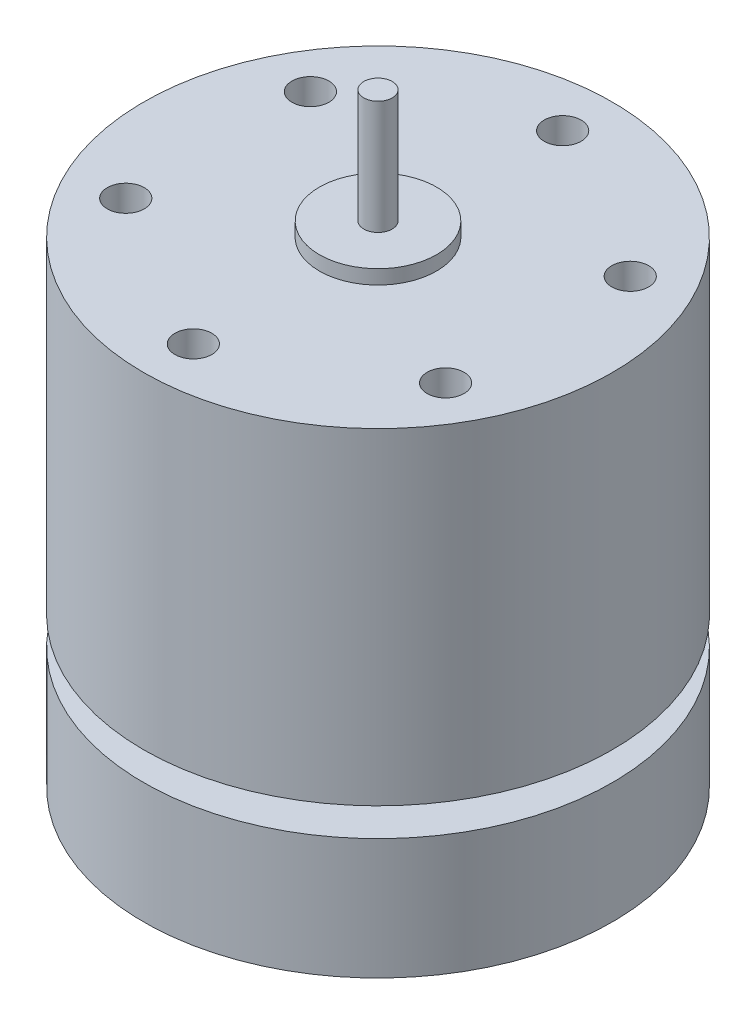
from build123d import *

# Parameters (mm, degrees)
SKETCH_1_R          = 16.5
EXTRUDE_1_DEPTH     = 23
SKETCH_2_R          = 4.125
EXTRUDE_2_DEPTH     = 1
SKETCH_3_R          = 1
EXTRUDE_3_DEPTH     = 8
SKETCH_4_R          = 3
EXTRUDE_4_DEPTH     = 2
EXTRUDE_START       = 8.5
SKETCH_5_R          = 16.5
EXTRUDE_5_DEPTH     = 8.5
SKETCH_6_R          = 1.3
CUT_EXTRUDE_1_DEPTH = 2


with BuildPart() as part:
    # 草图1 → 凸台-拉伸1 (new body)
    with BuildSketch(Plane(origin=(0, 0, 0), x_dir=(1, 0, 0), z_dir=(0, 1, 0))):
        with Locations(Location((0, 0, 0), (0, 0, 270))):
            Circle(SKETCH_1_R)
    extrude(amount=EXTRUDE_1_DEPTH)

    # 草图2 → 凸台-拉伸2 (add)
    with BuildSketch(Plane(origin=(0, 23, 0), x_dir=(1, 0, 0), z_dir=(0, 1, 0))):
        with Locations(Location((0, 0, 0), (0, 0, 270))):
            Circle(SKETCH_2_R)
    extrude(amount=EXTRUDE_2_DEPTH)

    # 草图3 → 凸台-拉伸3 (add)
    with BuildSketch(Plane(origin=(0, 24, 0), x_dir=(1, 0, 0), z_dir=(0, 1, 0))):
        with Locations(Location((0, 0, 0), (0, 0, 270))):
            Circle(SKETCH_3_R)
    extrude(amount=EXTRUDE_3_DEPTH)

    # 草图4 → 凸台-拉伸4 (add)
    with BuildSketch(Plane.XZ):
        with Locations(Location((0, 0, 0), (0, 0, 90))):
            Circle(SKETCH_4_R)
    extrude(amount=EXTRUDE_4_DEPTH)

    # 草图5 → 凸台-拉伸5 (add)
    with BuildSketch(Plane(origin=(0, -2, 0), x_dir=(-1, 0, 0), z_dir=(0, -1, 0)).offset(EXTRUDE_START)):
        with Locations(Location((0, 0, 0), (0, 0, 270))):
            Circle(SKETCH_5_R)
    extrude(amount=-EXTRUDE_5_DEPTH)

    # 草图6 → 切除-拉伸1 (cut)
    with BuildSketch(Plane(origin=(0, 23, 0), x_dir=(1, 0, 0), z_dir=(0, 1, 0))):
        with Locations(Location((-11.258330249, -6.5, 0), (0, 0, 270))):
            Circle(SKETCH_6_R)
        with Locations(Location((0, -13, 0), (0, 0, 270))):
            Circle(SKETCH_6_R)
        with Locations(Location((11.258330249, -6.5, 0), (0, 0, 270))):
            Circle(SKETCH_6_R)
        with Locations(Location((11.258330249, 6.5, 0), (0, 0, 270))):
            Circle(SKETCH_6_R)
        with Locations(Location((0, 13, 0), (0, 0, 270))):
            Circle(SKETCH_6_R)
        with Locations(Location((-11.258330249, 6.5, 0), (0, 0, 270))):
            Circle(SKETCH_6_R)
    extrude(amount=-CUT_EXTRUDE_1_DEPTH, mode=Mode.SUBTRACT)


solid = part.part
